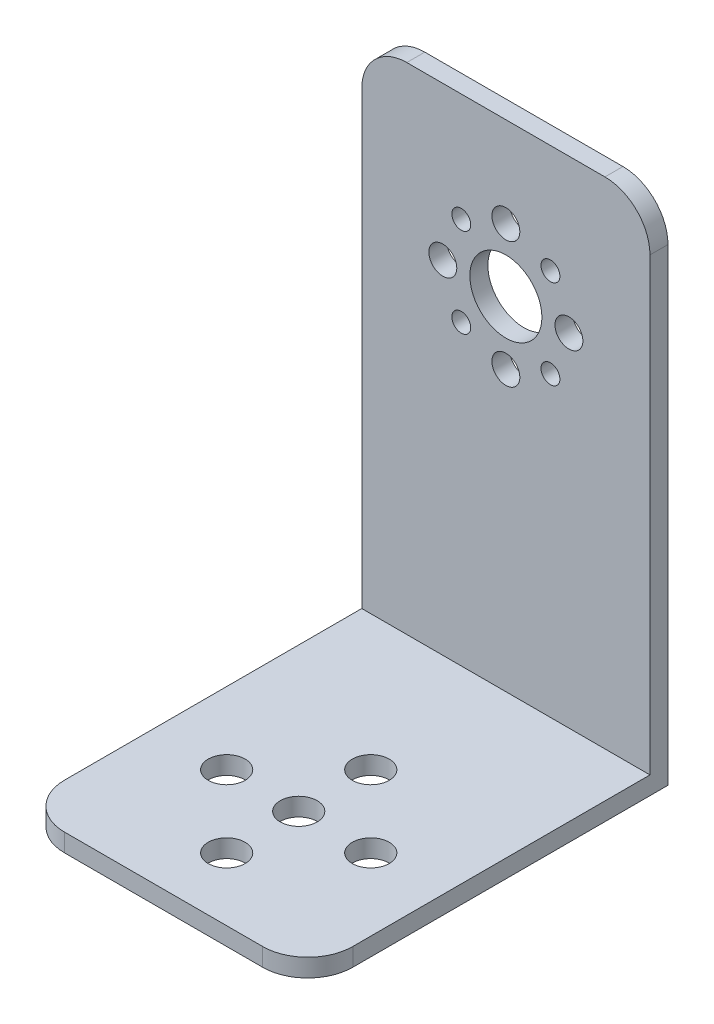
from build123d import *

# Parameters (mm, degrees)
SKETCH_2_W          = 32
SKETCH_2_H          = 40
EXTRUDE_1_DEPTH     = 2
SKETCH_3_W          = 32
SKETCH_3_H          = 2
EXTRUDE_2_DEPTH     = 55
SKETCH_6_R          = 2.05
CUT_EXTRUDE_2_DEPTH = 61.671245248
FILLET_1_R          = 5
SKETCH1_R           = 4
SKETCH1_R_2         = 1.55
SKETCH1_R_3         = 1.05
CUT_EXTRUDE1_DEPTH  = 10


with BuildPart() as part:
    # 草图2 → 凸台-拉伸1 (new body)
    with BuildSketch(Plane(origin=(0, 0, 0), x_dir=(1, 0, 0), z_dir=(0, 1, 0))):
        Rectangle(SKETCH_2_W, SKETCH_2_H)
    extrude(amount=EXTRUDE_1_DEPTH)

    # 草图3 → 凸台-拉伸2 (add)
    with BuildSketch(Plane(origin=(0, 2, 0), x_dir=(1, 0, 0), z_dir=(0, 1, 0))):
        with Locations((0, 19)):
            Rectangle(SKETCH_3_W, SKETCH_3_H)
    extrude(amount=EXTRUDE_2_DEPTH)

    # 草图6 → 切除-拉伸2 (cut, through all)
    with BuildSketch(Plane(origin=(0, 2, 0), x_dir=(1, 0, 0), z_dir=(0, 1, 0))):
        with Locations(Location((0, -5, 0), (0, 0, 270))):
            Circle(SKETCH_6_R)
        with Locations(Location((-8, -5, 0), (0, 0, 270))):
            Circle(SKETCH_6_R)
        with Locations(Location((8, -5, 0), (0, 0, 270))):
            Circle(SKETCH_6_R)
        with Locations(Location((0, 3, 0), (0, 0, 270))):
            Circle(SKETCH_6_R)
        with Locations(Location((0, -13, 0), (0, 0, 270))):
            Circle(SKETCH_6_R)
    extrude(amount=-CUT_EXTRUDE_2_DEPTH, mode=Mode.SUBTRACT)

    # 圆角1
    fillet_1_edges = [part.edges().sort_by_distance(p)[0] for p in [
        (-16, 57, -19),
        (16, 57, -19),
        (16, 1, 20),
        (-16, 1, 20),
    ]]
    fillet(fillet_1_edges, radius=FILLET_1_R)

    # Sketch1 → Cut-Extrude1 (cut)
    with BuildSketch(Plane.XY.offset(-18)):
        with Locations((0, 40)):
            Circle(SKETCH1_R)
        with Locations((0, 47)):
            Circle(SKETCH1_R_2)
        with Locations((4.949747468, 44.949747468)):
            Circle(SKETCH1_R_3)
        with Locations((7, 40)):
            Circle(SKETCH1_R_2)
        with Locations((4.949747468, 35.050252532)):
            Circle(SKETCH1_R_3)
        with Locations((0, 33)):
            Circle(SKETCH1_R_2)
        with Locations((-4.949747468, 35.050252532)):
            Circle(SKETCH1_R_3)
        with Locations((-4.949747468, 44.949747468)):
            Circle(SKETCH1_R_3)
        with Locations((-7, 40)):
            Circle(SKETCH1_R_2)
    extrude(amount=-CUT_EXTRUDE1_DEPTH, mode=Mode.SUBTRACT)


solid = part.part
